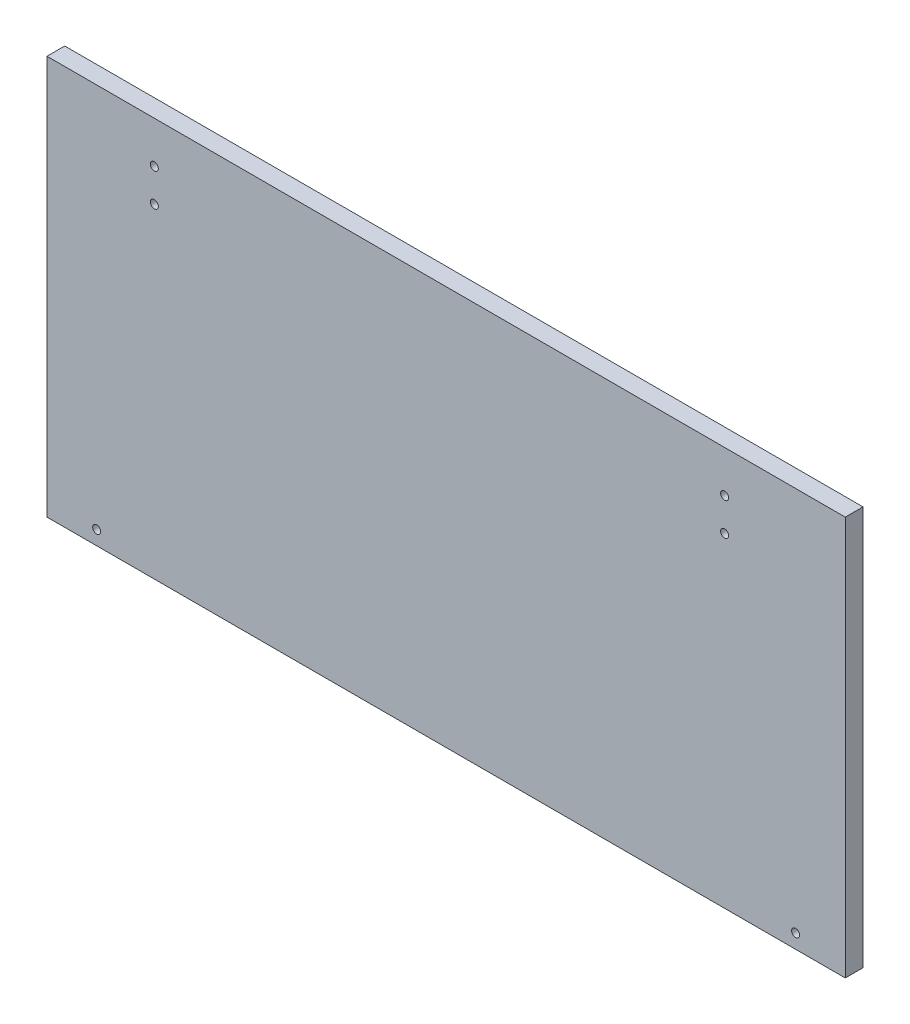
from build123d import *

# Parameters (mm, degrees)
SCHIZZO1_W                   = 450
SCHIZZO1_H                   = 225
ESTRUSIONE_ESTRUSIONE1_DEPTH = 10
SCHIZZO2_R                   = 2.25
TAGLIO_ESTRUSIONE1_DEPTH     = 10
SCHIZZO3_R                   = 2.25
TAGLIO_ESTRUSIONE2_DEPTH     = 10


with BuildPart() as part:
    # Schizzo1 → Estrusione-Estrusione1 (new body)
    with BuildSketch(Plane.XY):
        Rectangle(SCHIZZO1_W, SCHIZZO1_H)
    extrude(amount=ESTRUSIONE_ESTRUSIONE1_DEPTH)

    # Schizzo2 → Taglio-Estrusione1 (cut)
    with BuildSketch(Plane(origin=(0, 0, 0), x_dir=(-1, 0, 0), z_dir=(0, 0, -1))):
        with Locations((-157, 89)):
            Circle(SCHIZZO2_R)
        with Locations((-157, 70.5)):
            Circle(SCHIZZO2_R)
        with Locations((164.5, 89)):
            Circle(SCHIZZO2_R)
        with Locations((164.5, 70.5)):
            Circle(SCHIZZO2_R)
    extrude(amount=-TAGLIO_ESTRUSIONE1_DEPTH, mode=Mode.SUBTRACT)

    # Schizzo3 → Taglio-Estrusione2 (cut)
    with BuildSketch(Plane(origin=(0, 0, 0), x_dir=(-1, 0, 0), z_dir=(0, 0, -1))):
        with Locations((197, -104.5)):
            Circle(SCHIZZO3_R)
        with Locations((-197, -104.5)):
            Circle(SCHIZZO3_R)
    extrude(amount=-TAGLIO_ESTRUSIONE2_DEPTH, mode=Mode.SUBTRACT)


solid = part.part
